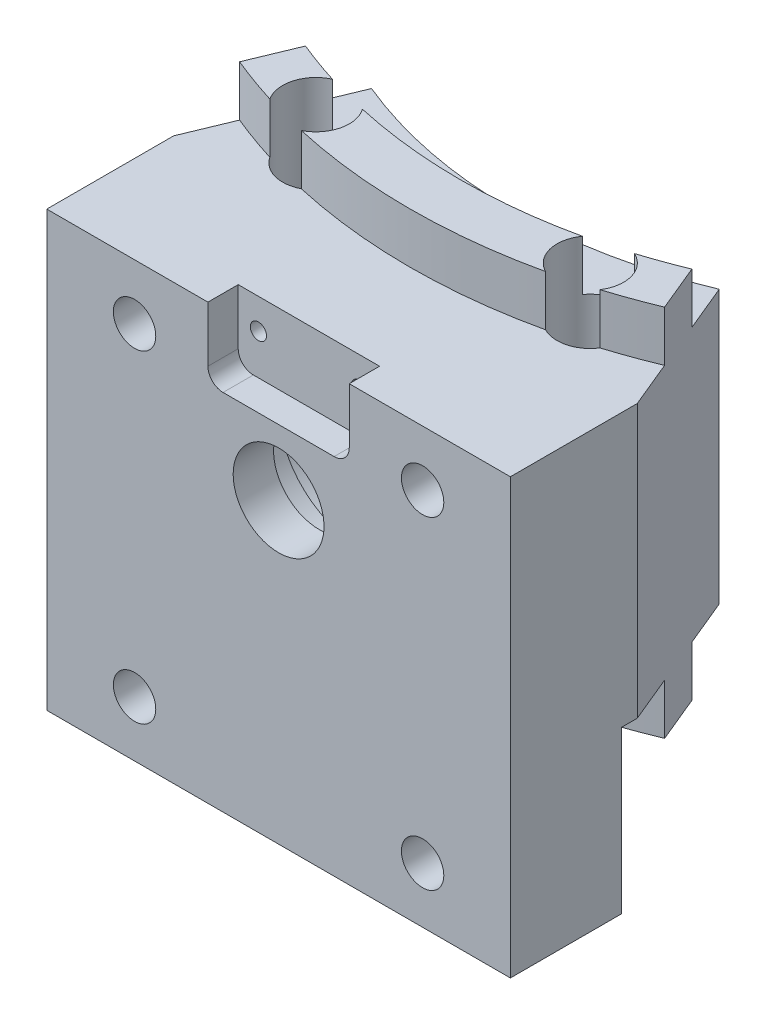
from build123d import *

# Parameters (mm, degrees)
BOSS_EXTRUDE1_DEPTH      = 13.5
BOSS_EXTRUDE2_DEPTH      = 18.5
BOSS_EXTRUDE3_DEPTH      = 5
SKETCH4_W                = 45.922011884
SKETCH4_H                = 20
BOSS_EXTRUDE4_DEPTH      = 13.5
SKETCH2_R                = 4
CUT_EXTRUDE1_DEPTH       = 268.629329099
SKETCH5_R                = 8
CUT_EXTRUDE2_DEPTH       = 4
SKETCH6_R                = 9
CUT_EXTRUDE3_DEPTH       = 12
SKETCH7_R                = 12.5
CUT_EXTRUDE4_DEPTH       = 5
BOSS_EXTRUDE5_DEPTH      = 13.5
CUT_EXTRUDE5_REACH       = 210.1
SKETCH8_R                = 9
CUT_EXTRUDE6_REACH       = 210.1
SKETCH10_R               = 4.5
SKETCH18_R               = 11
CUT_EXTRUDE9_DEPTH       = 47
CUT_EXTRUDE10_DEPTH      = 268.629329099
CUT_EXTRUDE10_DEPTH_BACK = 268.629329099
SKETCH19_W               = 45.922011884
SKETCH19_H               = 198
M6_CLEARANCE_HOLE1_D     = 6.6
SKETCH30_R               = 8.025
CUT_EXTRUDE13_DEPTH      = 4
BOSS_EXTRUDE9_DEPTH      = 16
M5_TAPPED_HOLE2_D        = 4.2
CUT_EXTRUDE16_DEPTH      = 3
M2_TAPPED_HOLE1_D        = 1.6
M2_TAPPED_HOLE1_DEPTH    = 8
M2_TAPPED_HOLE1_TIP      = 0.480688495


with BuildPart() as part:
    # Sketch1 → Boss-Extrude1 (new, symmetric)
    with BuildSketch(Plane(origin=(0, 0, 0), x_dir=(1, 0, 0), z_dir=(0, 1, 0))):
        with BuildLine():
            ThreePointArc((17.220754456, -41.574578963), (0, -45), (-17.220754456, -41.574578963))
            Line((-17.220754456, -41.574578963), (-22.961005942, -55.432771951))
            ThreePointArc((-22.961005942, -55.432771951), (0, -60), (22.961005942, -55.432771951))
            Line((22.961005942, -55.432771951), (17.220754456, -41.574578963))
        make_face()
    extrude(amount=BOSS_EXTRUDE1_DEPTH, both=True)

    # Sketch1<3> → Boss-Extrude2 (add, symmetric)
    with BuildSketch(Plane(origin=(0, 0, 0), x_dir=(1, 0, 0), z_dir=(0, 1, 0))):
        with BuildLine():
            ThreePointArc((19.134171618, -46.193976626), (0, -50), (-19.134171618, -46.193976626))
            Line((-19.134171618, -46.193976626), (-21.04758878, -50.813374288))
            ThreePointArc((-21.04758878, -50.813374288), (0, -55), (21.04758878, -50.813374288))
            Line((21.04758878, -50.813374288), (19.134171618, -46.193976626))
        make_face()
    extrude(amount=BOSS_EXTRUDE2_DEPTH, both=True)

    # Sketch3 → Boss-Extrude3 (add, symmetric)
    with BuildSketch(Plane.XZ):
        with BuildLine():
            Line((-22.961005942, 266), (-22.961005942, 55.432771951))
            ThreePointArc((-22.961005942, 55.432771951), (-20.481139434, 56.39612511), (-17.961005942, 57.248600555))
            Line((-17.961005942, 57.248600555), (-17.961005942, 246))
            Line((-17.961005942, 246), (17.961005942, 246))
            Line((17.961005942, 246), (17.961005942, 57.248600555))
            ThreePointArc((17.961005942, 57.248600555), (20.481139434, 56.39612511), (22.961005942, 55.432771951))
            Line((22.961005942, 55.432771951), (22.961005942, 266))
            Line((22.961005942, 266), (-22.961005942, 266))
        make_face()
    extrude(amount=BOSS_EXTRUDE3_DEPTH, both=True)

    # Sketch4 → Boss-Extrude4 (add, symmetric)
    with BuildSketch(Plane(origin=(0, 0, 0), x_dir=(1, 0, 0), z_dir=(0, 1, 0))):
        with Locations((0, -256)):
            Rectangle(SKETCH4_W, SKETCH4_H)
    extrude(amount=BOSS_EXTRUDE4_DEPTH, both=True)

    # Sketch2 → Cut-Extrude1 (cut, through all)
    with BuildSketch(Plane.XY):
        Circle(SKETCH2_R)
    extrude(amount=CUT_EXTRUDE1_DEPTH, mode=Mode.SUBTRACT)

    # Sketch5 → Cut-Extrude2 (cut)
    with BuildSketch(Plane(origin=(0, 0, 246), x_dir=(-1, 0, 0), z_dir=(0, 0, -1))):
        Circle(SKETCH5_R)
    extrude(amount=-CUT_EXTRUDE2_DEPTH, mode=Mode.SUBTRACT)

    # Sketch6 → Cut-Extrude3 (cut)
    with BuildSketch(Plane.XY.offset(266)):
        Circle(SKETCH6_R)
    extrude(amount=-CUT_EXTRUDE3_DEPTH, mode=Mode.SUBTRACT)

    # Sketch7 → Cut-Extrude4 (cut)
    with BuildSketch(Plane.XY.offset(266)):
        Circle(SKETCH7_R)
    extrude(amount=-CUT_EXTRUDE4_DEPTH, mode=Mode.SUBTRACT)

    # Sketch9 → Boss-Extrude5 (add, symmetric)
    with BuildSketch(Plane(origin=(0, 0, 0), x_dir=(1, 0, 0), z_dir=(0, 1, 0))):
        with BuildLine():
            Line((-22.961005942, -55.432771951), (-22.961005942, -68))
            Line((-22.961005942, -68), (22.961005942, -68))
            Line((22.961005942, -68), (22.961005942, -55.432771951))
            ThreePointArc((22.961005942, -55.432771951), (0, -60), (-22.961005942, -55.432771951))
        make_face()
    extrude(amount=BOSS_EXTRUDE5_DEPTH, both=True)

    # Sketch8 → Cut-Extrude5 (cut, up to next)
    with BuildSketch(Plane.XY.offset(60), mode=Mode.PRIVATE) as cut_extrude5_sk1:
        Circle(SKETCH8_R)
    cut_extrude5_tool1 = extrude(cut_extrude5_sk1.sketch, amount=-CUT_EXTRUDE5_REACH, mode=Mode.PRIVATE) & part.part
    add(cut_extrude5_tool1.solids().sort_by_distance((0, 0, 60))[0], mode=Mode.SUBTRACT)

    # Sketch10 → Cut-Extrude6 (cut, up to next)
    with BuildSketch(Plane.XY.offset(60), mode=Mode.PRIVATE) as cut_extrude6_sk1:
        Circle(SKETCH10_R)
    cut_extrude6_tool1 = extrude(cut_extrude6_sk1.sketch, amount=CUT_EXTRUDE6_REACH, mode=Mode.PRIVATE) & part.part
    add(cut_extrude6_tool1.solids().sort_by_distance((0, 0, 60))[0], mode=Mode.SUBTRACT)

    # Sketch18 → Cut-Extrude9 (cut)
    with BuildSketch(Plane.XY):
        Circle(SKETCH18_R)
    extrude(amount=CUT_EXTRUDE9_DEPTH, mode=Mode.SUBTRACT)

    # Sketch19 → Cut-Extrude10 (cut, two sides: drawn at the far end of the back side and taken through both)
    with BuildSketch(Plane(origin=(0, 0, 0), x_dir=(1, 0, 0), z_dir=(0, 1, 0)).offset(-CUT_EXTRUDE10_DEPTH_BACK)):
        with Locations((0, -167)):
            Rectangle(SKETCH19_W, SKETCH19_H)
    extrude(amount=CUT_EXTRUDE10_DEPTH + CUT_EXTRUDE10_DEPTH_BACK, mode=Mode.SUBTRACT)

    # Sketch23 → M5 Tapped Hole1 (revolve, cut)
    with BuildSketch(Plane(origin=(14.26606865, 8, 68), x_dir=(0, -1, 0), z_dir=(1, 0, 0))):
        Polygon((0, 0), (0, 11.3618073), (2.1, 10.1), (2.1, 0), align=None)
    m5_tapped_hole1 = revolve(axis=Axis((14.26606865, 8, 74.35), (0, 0, -1)), mode=Mode.SUBTRACT)

    # Mirror1: M5 Tapped Hole1 across plane
    add(m5_tapped_hole1.mirror(Plane(origin=(0, 0, 0), x_dir=(0, 0, 1), z_dir=(1, 0, 0))), mode=Mode.SUBTRACT)

    # M6 Clearance Hole1 (through all)
    with Locations(Plane(origin=(0, 18.5, 0), x_dir=(1, 0, 0), z_dir=(0, 1, 0))):
        with Locations((-13.587999868, -50.71110588), (13.587999868, -50.71110588)):
            Hole(M6_CLEARANCE_HOLE1_D / 2)

    # Sketch30 → Cut-Extrude13 (cut)
    with BuildSketch(Plane(origin=(0, 0, 60), x_dir=(-1, 0, 0), z_dir=(0, 0, -1))):
        Circle(SKETCH30_R)
    extrude(amount=-CUT_EXTRUDE13_DEPTH, mode=Mode.SUBTRACT)

    # Sketch37 → Boss-Extrude9 (add)
    with BuildSketch(Plane.XZ.offset(13.5)):
        with BuildLine():
            Line((-22.961005942, 68), (22.961005942, 68))
            Line((22.961005942, 68), (22.961005942, 57))
            ThreePointArc((22.961005942, 57), (0, 61.450856738), (-22.961005942, 57))
            Line((-22.961005942, 57), (-22.961005942, 68))
        make_face()
    extrude(amount=BOSS_EXTRUDE9_DEPTH)

    # M5 Tapped Hole2 (through all)
    with Locations(Plane.XY.offset(68)):
        with Locations((-14.26606865, -24), (14.26606865, -24)):
            Hole(M5_TAPPED_HOLE2_D / 2)

    # Sketch41 → Cut-Extrude16 (cut)
    with BuildSketch(Plane.XY.offset(68)):
        with BuildLine():
            Line((-7, 13.5), (-7, 8))
            ThreePointArc((-7, 8), (-6.560660172, 6.939339828), (-5.5, 6.5))
            Line((-5.5, 6.5), (5.5, 6.5))
            ThreePointArc((5.5, 6.5), (6.560660172, 6.939339828), (7, 8))
            Line((7, 8), (7, 13.5))
            Line((7, 13.5), (-7, 13.5))
        make_face()
    extrude(amount=-CUT_EXTRUDE16_DEPTH, mode=Mode.SUBTRACT)

    # M2 Tapped Hole1
    with Locations(Plane.XY.offset(65)):
        with Locations((-5, 10.5), (5, 10.5)):
            Hole(M2_TAPPED_HOLE1_D / 2, depth=M2_TAPPED_HOLE1_DEPTH)
            with Locations((0, 0, -(M2_TAPPED_HOLE1_DEPTH + M2_TAPPED_HOLE1_TIP / 2))):  # 118° drill point
                Cone(0, M2_TAPPED_HOLE1_D / 2, M2_TAPPED_HOLE1_TIP, mode=Mode.SUBTRACT)


solid = part.part
